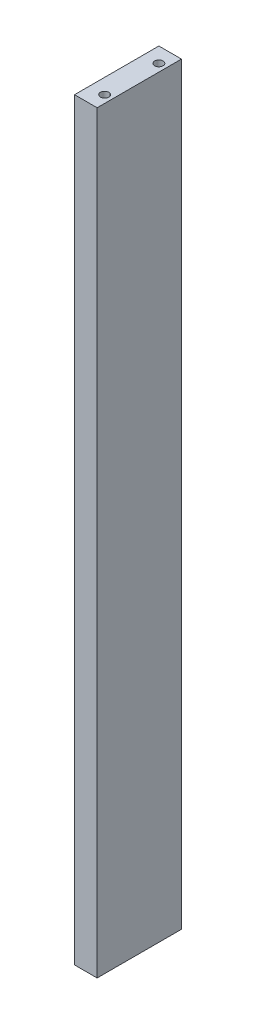
from build123d import *

# Parameters (mm, degrees)
SKETCH1_W           = 7.5
SKETCH1_H           = 28
SKETCH1_R           = 1.4
BOSS_EXTRUDE1_DEPTH = 250.2
CUT_EXTRUDE1_DEPTH  = 2


with BuildPart() as part:
    # Sketch1 → Boss-Extrude1 (new body)
    with BuildSketch(Plane(origin=(0, 0, 0), x_dir=(1, 0, 0), z_dir=(0, 1, 0))):
        Rectangle(SKETCH1_W, SKETCH1_H)
        with Locations(Location((1.25, -9, 0), (0, 0, 270))):
            Circle(SKETCH1_R, mode=Mode.SUBTRACT)
        with Locations(Location((1.25, 9, 0), (0, 0, 270))):
            Circle(SKETCH1_R, mode=Mode.SUBTRACT)
    extrude(amount=BOSS_EXTRUDE1_DEPTH)

    # Sketch3 → Cut-Extrude1 (cut)
    with BuildSketch(Plane.ZY.offset(3.75)):
        with BuildLine():
            Line((-1.476181201, 137.36625), (-3.572358506, 125.744325))
            ThreePointArc((-3.572358506, 125.744325), (-3.63, 125.1), (-3.572358506, 124.455675))
            Line((-3.572358506, 124.455675), (-1.476181201, 112.83375))
            ThreePointArc((-1.476181201, 112.83375), (0, 111.6), (1.476181201, 112.83375))
            Line((1.476181201, 112.83375), (3.572358506, 124.455675))
            ThreePointArc((3.572358506, 124.455675), (3.63, 125.1), (3.572358506, 125.744325))
            Line((3.572358506, 125.744325), (1.476181201, 137.36625))
            ThreePointArc((1.476181201, 137.36625), (0, 138.6), (-1.476181201, 137.36625))
        make_face()
    extrude(amount=-CUT_EXTRUDE1_DEPTH, mode=Mode.SUBTRACT)


solid = part.part
